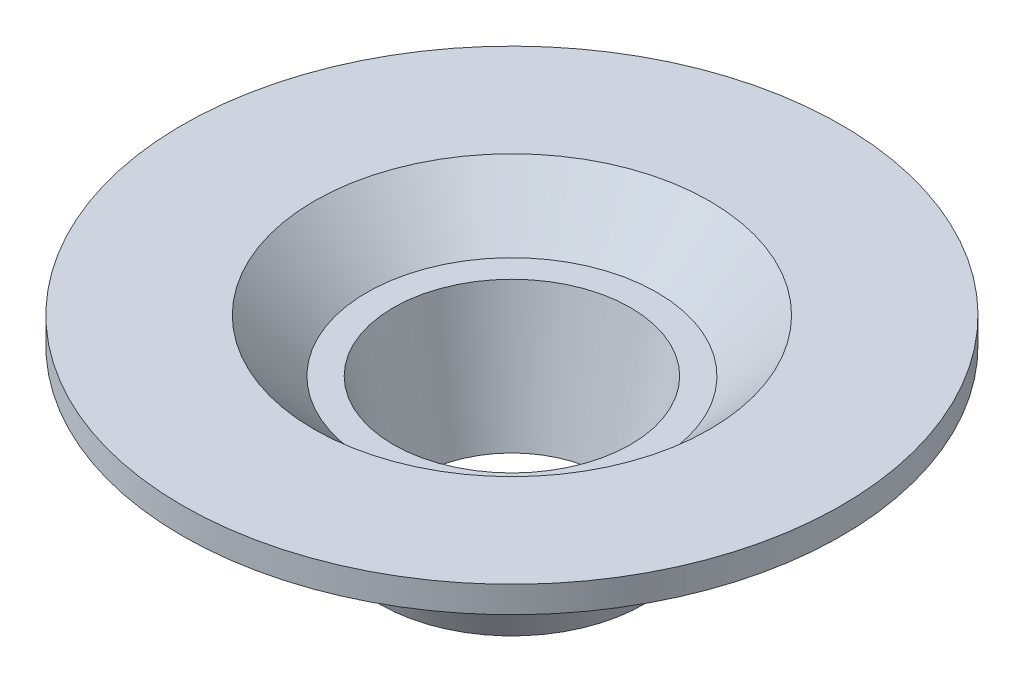
from build123d import *


with BuildPart() as part:
    # Sketch1 → Revolve1 (revolve)
    with BuildSketch(Plane(origin=(0, 0, 0), x_dir=(0, 0, -1), z_dir=(1, 0, 0)), mode=Mode.PRIVATE) as revolve1_sk:
        Polygon((3.5, -5), (4.5, 0), (5.5, 0), (7.5, 2), (12.5, 2), (12.5, 1), (10.5, 1), (8.5, -1), (6.5, -1), (5, -5), align=None)
    revolve(revolve1_sk.sketch.rotate(Axis((0, 0, 0), (0, -1, 0)), 180), axis=Axis((0, 0, 0), (0, -1, 0)))


solid = part.part
